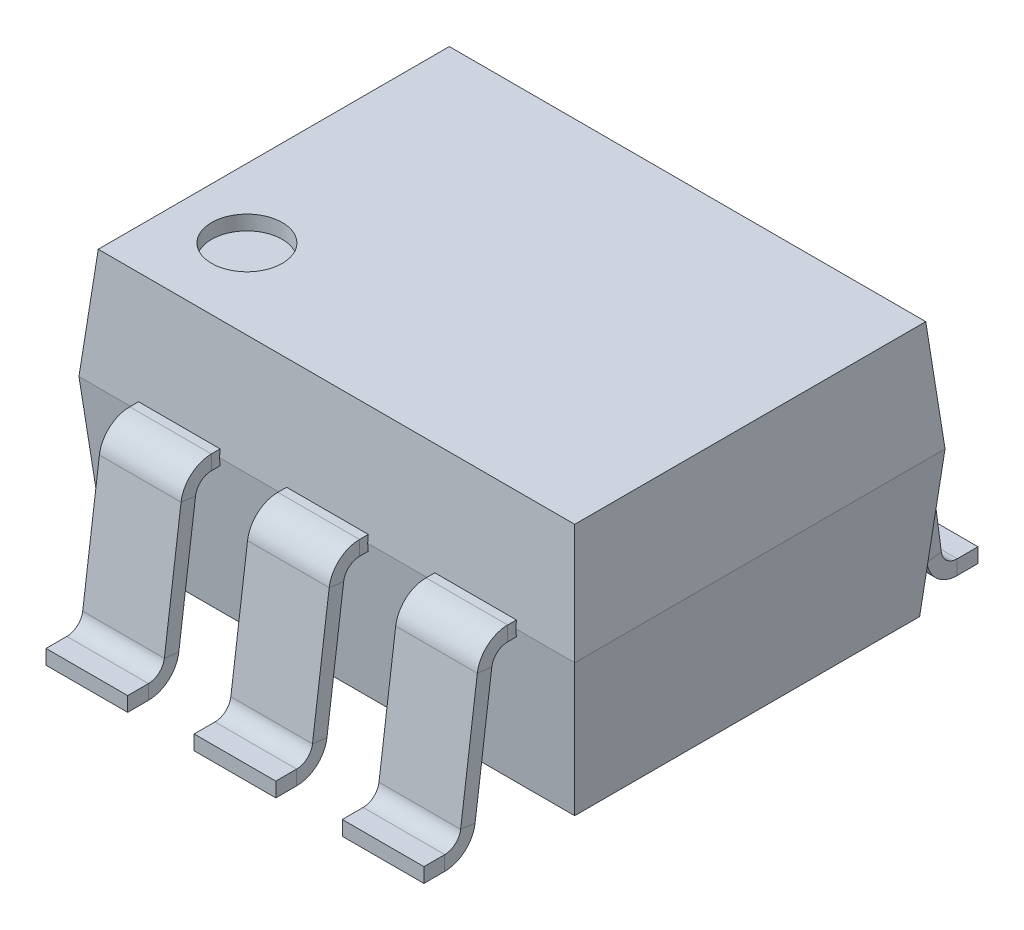
from build123d import *

# Parameters (mm, degrees)
SKETCH1_W                     = 8.5
SKETCH1_H                     = 6.35
BOSS_EXTRUDE1_DEPTH           = 1.89
BOSS_EXTRUDE1_TAPER           = 5
BOSS_EXTRUDE1_OTHER_WAY_DEPTH = 2.49
BOSS_EXTRUDE1_OTHER_WAY_TAPER = 5
SKETCH2_W                     = 1.4
SKETCH2_H                     = 0.25
LPATTERN1_COUNT               = 2
LPATTERN1_PITCH               = 2.54
LPATTERN1_COL_COUNT           = 2
LPATTERN1_COL_PITCH           = 2.54
MIRROR1_COPY_1_SKETCH_W       = 1.4
MIRROR1_COPY_1_SKETCH_H       = 0.25
MIRROR1_COPY_2_SKETCH_W       = 1.4
MIRROR1_COPY_2_SKETCH_H       = 0.25
SKETCH4_R                     = 0.606643951
CUT_EXTRUDE1_DEPTH            = 0.25


with BuildPart() as part:
    # Sketch1 → Boss-Extrude1 (new body)
    with BuildSketch(Plane(origin=(0, 0, 0), x_dir=(1, 0, 0), z_dir=(0, 1, 0))):
        Rectangle(SKETCH1_W, SKETCH1_H)
    extrude(amount=BOSS_EXTRUDE1_DEPTH, taper=BOSS_EXTRUDE1_TAPER)

    # Sketch1 → Boss-Extrude1 other way (add)
    with BuildSketch(Plane(origin=(0, 0, 0), x_dir=(1, 0, 0), z_dir=(0, 1, 0))):
        Rectangle(SKETCH1_W, SKETCH1_H)
    extrude(amount=-BOSS_EXTRUDE1_OTHER_WAY_DEPTH, taper=BOSS_EXTRUDE1_OTHER_WAY_TAPER)

    # Sweep1: sweep along a path in Sketch3
    with BuildLine(Plane(origin=(0, 0, 0), x_dir=(0, 0, -1), z_dir=(1, 0, 0))) as sweep1_path:
        Line((0, 0), (-3.3139807, 0))
        ThreePointArc((-3.3139807, 0), (-3.577719026, -0.099264077), (-3.710558645, -0.347789523))
        Line((-3.710558645, -0.347789523), (-3.996826594, -2.522210477))
        ThreePointArc((-3.996826594, -2.522210477), (-4.129666213, -2.770735923), (-4.393404539, -2.87))
        Line((-4.393404539, -2.87), (-4.75, -2.87))
    # Sketch2 → Sweep1 (sweep)
    with BuildSketch(Plane.XY):
        Rectangle(SKETCH2_W, SKETCH2_H)
    sweep1 = sweep(path=sweep1_path.line)

    # LPattern1: Sweep1 ×2
    with Locations(*[(i * LPATTERN1_PITCH, 0, 0) for i in range(1, LPATTERN1_COUNT)]):
        add(sweep1)

    # LPattern1 col: Sweep1 ×2
    with Locations(*[(-i * LPATTERN1_COL_PITCH, 0, 0) for i in range(1, LPATTERN1_COL_COUNT)]):
        add(sweep1)

    # Mirror1: Sweep1 across plane
    add(sweep1.mirror(Plane.XY))

    # Mirror1 copy 1: sweep along a path in Mirror1 copy 1 path
    with BuildLine(Plane(origin=(2.54, 0, 0), x_dir=(0, 0, 1), z_dir=(1, 0, 0))) as mirror1_copy_1_path:
        Line((0, 0), (-3.3139807, 0))
        ThreePointArc((-3.3139807, 0), (-3.577719026, 0.099264077), (-3.710558645, 0.347789523))
        Line((-3.710558645, 0.347789523), (-3.996826594, 2.522210477))
        ThreePointArc((-3.996826594, 2.522210477), (-4.129666213, 2.770735923), (-4.393404539, 2.87))
        Line((-4.393404539, 2.87), (-4.75, 2.87))
    # Mirror1 copy 1 sketch → Mirror1 copy 1 (sweep)
    with BuildSketch(Plane(origin=(2.54, 0, 0), x_dir=(1, 0, 0), z_dir=(0, 0, -1))):
        Rectangle(MIRROR1_COPY_1_SKETCH_W, MIRROR1_COPY_1_SKETCH_H)
    sweep(path=mirror1_copy_1_path.line)

    # Mirror1 copy 2: sweep along a path in Mirror1 copy 2 path
    with BuildLine(Plane(origin=(-2.54, 0, 0), x_dir=(0, 0, 1), z_dir=(1, 0, 0))) as mirror1_copy_2_path:
        Line((0, 0), (-3.3139807, 0))
        ThreePointArc((-3.3139807, 0), (-3.577719026, 0.099264077), (-3.710558645, 0.347789523))
        Line((-3.710558645, 0.347789523), (-3.996826594, 2.522210477))
        ThreePointArc((-3.996826594, 2.522210477), (-4.129666213, 2.770735923), (-4.393404539, 2.87))
        Line((-4.393404539, 2.87), (-4.75, 2.87))
    # Mirror1 copy 2 sketch → Mirror1 copy 2 (sweep)
    with BuildSketch(Plane(origin=(-2.54, 0, 0), x_dir=(1, 0, 0), z_dir=(0, 0, -1))):
        Rectangle(MIRROR1_COPY_2_SKETCH_W, MIRROR1_COPY_2_SKETCH_H)
    sweep(path=mirror1_copy_2_path.line)

    # Sketch4 → Cut-Extrude1 (cut)
    with BuildSketch(Plane(origin=(0, 1.89, 0), x_dir=(1, 0, 0), z_dir=(0, 1, 0))):
        with Locations(Location((-2.903482354, -1.641715186, 0), (0, 0, 270))):
            Circle(SKETCH4_R)
    extrude(amount=-CUT_EXTRUDE1_DEPTH, mode=Mode.SUBTRACT)


solid = part.part
